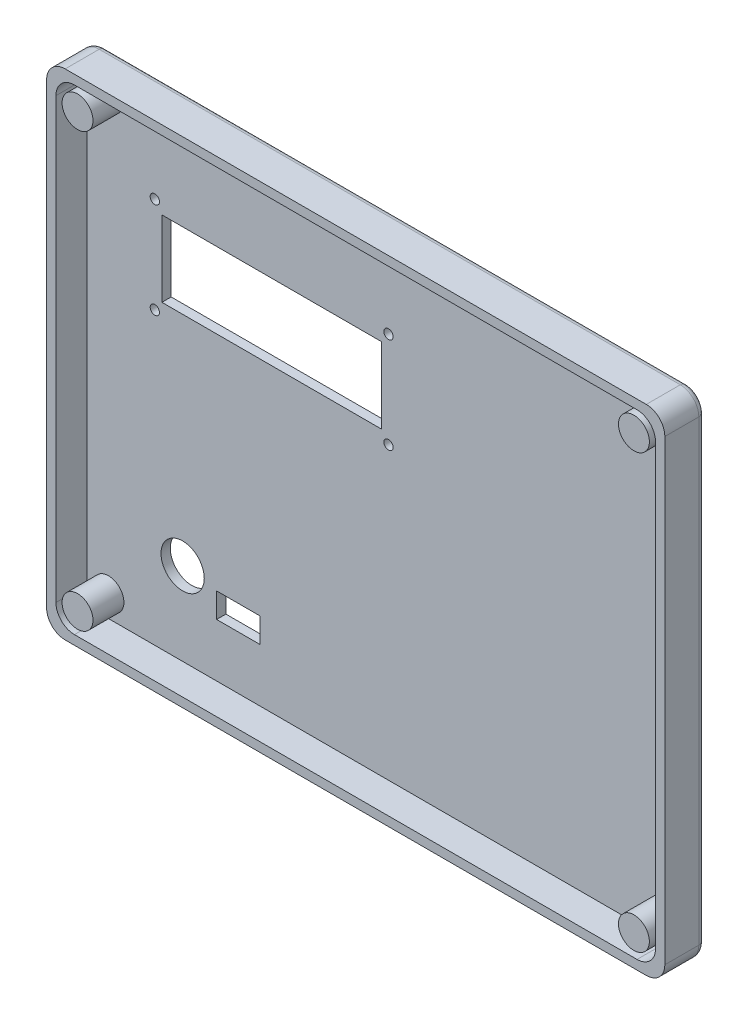
from build123d import *

# Parameters (mm, degrees)
BOSS_EXTRU_1_DEPTH      = 3
BOSS_EXTRU_2_START      = 10
BOSS_EXTRU_2_DEPTH      = 10
ESQUISSE2_R             = 5
BOSS_EXTRU_3_DEPTH      = 10
CONG_1_R                = 2
BOSS_EXTRU_4_START      = -3.5
ESQUISSE2_2_R           = 5
BOSS_EXTRU_4_DEPTH      = 3.5
ESQUISSE3_R             = 1.5
ESQUISSE3_W             = 71
ESQUISSE3_H             = 24.5
ENL_V_MAT_EXTRU_1_DEPTH = 3.5
ESQUISSE4_R             = 7
ESQUISSE4_W             = 14
ESQUISSE4_H             = 8
ENL_V_MAT_EXTRU_2_DEPTH = 10


with BuildPart() as part:
    # Esquisse1 → Boss.-Extru.1 (new body)
    with BuildSketch(Plane.XY):
        with BuildLine():
            ThreePointArc((-100, -74), (-98.242640687, -78.242640687), (-94, -80))
            Line((-94, -80), (94, -80))
            ThreePointArc((94, -80), (98.242640687, -78.242640687), (100, -74))
            Line((100, -74), (100, 74))
            ThreePointArc((100, 74), (98.242640687, 78.242640687), (94, 80))
            Line((94, 80), (-94, 80))
            ThreePointArc((-94, 80), (-98.242640687, 78.242640687), (-100, 74))
            Line((-100, 74), (-100, -74))
        make_face()
    extrude(amount=-BOSS_EXTRU_1_DEPTH)

    # Esquisse1<3> → Boss.-Extru.2 (add)
    with BuildSketch(Plane.XY.offset(BOSS_EXTRU_2_START)):
        with BuildLine():
            Line((-94, -80), (94, -80))
            ThreePointArc((94, -80), (98.242640687, -78.242640687), (100, -74))
            Line((100, -74), (100, 74))
            ThreePointArc((100, 74), (98.242640687, 78.242640687), (94, 80))
            Line((94, 80), (-94, 80))
            ThreePointArc((-94, 80), (-98.242640687, 78.242640687), (-100, 74))
            Line((-100, 74), (-100, -74))
            ThreePointArc((-100, -74), (-98.242640687, -78.242640687), (-94, -80))
        make_face()
        with BuildLine():
            Line((-91, -77), (91, -77))
            ThreePointArc((91, -77), (95.242640687, -75.242640687), (97, -71))
            Line((97, -71), (97, 71))
            ThreePointArc((97, 71), (95.242640687, 75.242640687), (91, 77))
            Line((91, 77), (-91, 77))
            ThreePointArc((-91, 77), (-95.242640687, 75.242640687), (-97, 71))
            Line((-97, 71), (-97, -71))
            ThreePointArc((-97, -71), (-95.242640687, -75.242640687), (-91, -77))
        make_face(mode=Mode.SUBTRACT)
    extrude(amount=-BOSS_EXTRU_2_DEPTH)

    # Esquisse2 → Boss.-Extru.3 (add)
    with BuildSketch(Plane.XY):
        with Locations((-90, 70)):
            Circle(ESQUISSE2_R)
        with Locations((90, 70)):
            Circle(ESQUISSE2_R)
        with Locations((90, -70)):
            Circle(ESQUISSE2_R)
        with Locations((-90, -70)):
            Circle(ESQUISSE2_R)
    extrude(amount=BOSS_EXTRU_3_DEPTH)

    # Congé1
    cong_1_edges = [part.edges().sort_by_distance(p)[0] for p in [
        (-100, 0, -3),
        (-98.242640687, -78.242640687, -3),
        (0, -80, -3),
        (98.242640687, -78.242640687, -3),
        (100, 0, -3),
        (98.242640687, 78.242640687, -3),
        (0, 80, -3),
        (-98.242640687, 78.242640687, -3),
    ]]
    fillet(cong_1_edges, radius=CONG_1_R)

    # Esquisse2<2> → Boss.-Extru.4 (add)
    with BuildSketch(Plane.XY.offset(BOSS_EXTRU_4_START)):
        with Locations((-90, 70)):
            Circle(ESQUISSE2_2_R)
        with Locations((90, 70)):
            Circle(ESQUISSE2_2_R)
        with Locations((90, -70)):
            Circle(ESQUISSE2_2_R)
        with Locations((-90, -70)):
            Circle(ESQUISSE2_2_R)
    extrude(amount=BOSS_EXTRU_4_DEPTH)

    # Esquisse3 → Enlèv. mat.-Extru.1 (cut)
    with BuildSketch(Plane(origin=(0, 0, -3), x_dir=(-1, 0, 0), z_dir=(0, 0, -1))):
        with Locations((-0.6, 48)):
            Circle(ESQUISSE3_R)
        with Locations((-0.6, 17)):
            Circle(ESQUISSE3_R)
        with Locations((75, 17)):
            Circle(ESQUISSE3_R)
        with Locations((75, 48)):
            Circle(ESQUISSE3_R)
        with Locations((37.2, 32.5)):
            Rectangle(ESQUISSE3_W, ESQUISSE3_H)
    extrude(amount=-ENL_V_MAT_EXTRU_1_DEPTH, mode=Mode.SUBTRACT)

    # Esquisse4 → Enlèv. mat.-Extru.2 (cut)
    with BuildSketch(Plane(origin=(0, 0, -3), x_dir=(-1, 0, 0), z_dir=(0, 0, -1))):
        with Locations((66, -50.25)):
            Circle(ESQUISSE4_R)
        with Locations((48, -55.75)):
            Rectangle(ESQUISSE4_W, ESQUISSE4_H)
    extrude(amount=-ENL_V_MAT_EXTRU_2_DEPTH, mode=Mode.SUBTRACT)


solid = part.part
